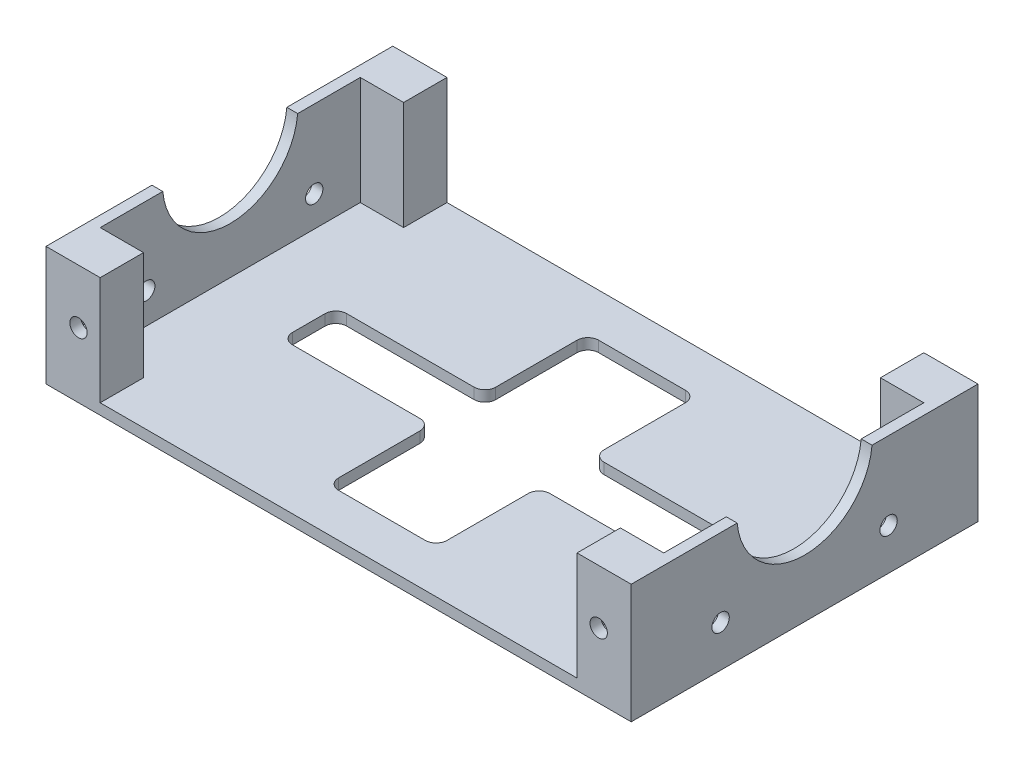
from build123d import *

# Parameters (mm, degrees)
SZKIC1_W                    = 104
SZKIC1_H                    = 64
DODANIE_WYCI_GNI_CIE1_DEPTH = 2
SZKIC2_W                    = 8
SZKIC2_H                    = 8
DODANIE_WYCI_GNI_CIE2_DEPTH = 20
SZKIC4_R                    = 1.6
DODANIE_WYCI_GNI_CIE3_DEPTH = 2
DODANIE_WYCI_GNI_CIE4_START = 2
SZKIC5_R                    = 1.6
DODANIE_WYCI_GNI_CIE4_DEPTH = 2
SFAZOWANIE1_SIZE            = 2
SZKIC6_W                    = 5.65685425
SZKIC6_H                    = 5.65685425
SZKIC6_R                    = 1.6
WYTNIJ_WYCI_GNI_CIE2_DEPTH  = 4
SZKIC6_AGAIN_R              = 1.6
WYTNIJ_WYCI_GNI_CIE3_DEPTH  = 6.2
DODANIE_WYCI_GNI_CIE5_DEPTH = 2
SZKIC8_W                    = 5.65685425
SZKIC8_H                    = 5.65685425
SZKIC8_R                    = 1.6
WYTNIJ_WYCI_GNI_CIE4_DEPTH  = 4
SZKIC8_2_R                  = 1.6
WYTNIJ_WYCI_GNI_CIE5_DEPTH  = 4.2
SZKIC8_3_W                  = 5.65685425
SZKIC8_3_H                  = 5.65685425
SZKIC8_3_R                  = 1.6
DODANIE_WYCI_GNI_CIE6_DEPTH = 2
WYTNIJ_WYCI_GNI_CIE6_START  = -4
SZKIC9_W                    = 5.65685425
SZKIC9_H                    = 5.65685425
SZKIC9_R                    = 1.6
WYTNIJ_WYCI_GNI_CIE6_DEPTH  = 4
WYTNIJ_WYCI_GNI_CIE7_START  = -4.2
SZKIC9_2_R                  = 1.6
WYTNIJ_WYCI_GNI_CIE7_DEPTH  = 4.2
DODANIE_WYCI_GNI_CIE7_START = -2
SZKIC9_3_W                  = 5.65685425
SZKIC9_3_H                  = 5.65685425
SZKIC9_3_R                  = 1.6
DODANIE_WYCI_GNI_CIE7_DEPTH = 2
SZKIC10_W                   = 20
SZKIC10_H                   = 10
SZKIC10_W_2                 = 27.5
SZKIC10_H_2                 = 19
WYTNIJ_WYCI_GNI_CIE8_DEPTH  = 9
SZKIC11_W                   = 2
SZKIC11_H                   = 2
DODANIE_WYCI_GNI_CIE8_DEPTH = 64
ZAOKR_GLENIE1_R             = 2


with BuildPart() as part:
    # Szkic1 → Dodanie-wyciągnięcie1 (new body)
    with BuildSketch(Plane(origin=(0, 0, 0), x_dir=(1, 0, 0), z_dir=(0, 1, 0))):
        with Locations((52, 32)):
            Rectangle(SZKIC1_W, SZKIC1_H)
    extrude(amount=DODANIE_WYCI_GNI_CIE1_DEPTH)

    # Szkic2 → Dodanie-wyciągnięcie2 (add)
    with BuildSketch(Plane(origin=(0, 2, 0), x_dir=(1, 0, 0), z_dir=(0, 1, 0))):
        with Locations((4, 60)):
            Rectangle(SZKIC2_W, SZKIC2_H)
        with Locations((4, 4)):
            Rectangle(SZKIC2_W, SZKIC2_H)
        with Locations((100, 4)):
            Rectangle(SZKIC2_W, SZKIC2_H)
        with Locations((100, 60)):
            Rectangle(SZKIC2_W, SZKIC2_H)
    extrude(amount=DODANIE_WYCI_GNI_CIE2_DEPTH)

    # Szkic4 → Dodanie-wyciągnięcie3 (add)
    # profile 1 of 2: a face of its own
    with BuildSketch(Plane.ZY):
        with BuildLine():
            Line((-8, 2), (-8, 22))
            Line((-8, 22), (-19.553012413, 22))
            ThreePointArc((-19.553012413, 22), (-32, 10.65), (-44.446987587, 22))
            Line((-44.446987587, 22), (-56, 22))
            Line((-56, 22), (-56, 2))
            Line((-56, 2), (-8, 2))
        make_face()
        with Locations((-47.5, 7.65)):
            Circle(SZKIC4_R, mode=Mode.SUBTRACT)
        with Locations((-16.5, 7.65)):
            Circle(SZKIC4_R, mode=Mode.SUBTRACT)
    # profile 2 of 2: a face of its own
    with BuildSketch(Plane.ZY):
        Polygon((-64, 22), (-64, 0), (0, 0), (0, 22), (-8, 22), (-8, 2), (-56, 2), (-56, 22), align=None)
    extrude(amount=DODANIE_WYCI_GNI_CIE3_DEPTH)

    # Szkic5 → Dodanie-wyciągnięcie4 (add)
    # profile 1 of 2: a face of its own
    with BuildSketch(Plane(origin=(104, 0, 0), x_dir=(0, 0, -1), z_dir=(1, 0, 0)).offset(DODANIE_WYCI_GNI_CIE4_START)):
        with BuildLine():
            Line((56, 2), (56, 22))
            Line((56, 22), (44.446987587, 22))
            ThreePointArc((44.446987587, 22), (32, 10.65), (19.553012413, 22))
            Line((19.553012413, 22), (8, 22))
            Line((8, 22), (8, 2))
            Line((8, 2), (56, 2))
        make_face()
        with Locations(Location((16.5, 7.65, 0), (0, 0, 180))):
            Circle(SZKIC5_R, mode=Mode.SUBTRACT)
        with Locations(Location((47.5, 7.65, 0), (0, 0, 180))):
            Circle(SZKIC5_R, mode=Mode.SUBTRACT)
    # profile 2 of 2: a face of its own
    with BuildSketch(Plane(origin=(104, 0, 0), x_dir=(0, 0, -1), z_dir=(1, 0, 0)).offset(DODANIE_WYCI_GNI_CIE4_START)):
        Polygon((0, 22), (0, 0), (64, 0), (64, 22), (56, 22), (56, 2), (8, 2), (8, 22), align=None)
    extrude(amount=-DODANIE_WYCI_GNI_CIE4_DEPTH)

    # Sfazowanie1
    sfazowanie1_edges = [part.edges().sort_by_distance(p)[0] for p in [
        (-2, 0, -32),
        (106, 0, -32),
    ]]
    chamfer(sfazowanie1_edges, length=SFAZOWANIE1_SIZE)

    # Szkic6 → Wytnij-wyciągnięcie2 (cut)
    # profile 1 of 4: a face of its own
    with BuildSketch(Plane.XZ):
        with Locations((4, -4)):
            Rectangle(SZKIC6_W, SZKIC6_H)
        with Locations(Location((4, -4, 0), (0, 0, 270))):
            Circle(SZKIC6_R, mode=Mode.SUBTRACT)
    # profile 2 of 4: a face of its own
    with BuildSketch(Plane.XZ):
        with Locations((4, -60)):
            Rectangle(SZKIC6_W, SZKIC6_H)
        with Locations(Location((4, -60, 0), (0, 0, 270))):
            Circle(SZKIC6_R, mode=Mode.SUBTRACT)
    # profile 3 of 4: a face of its own
    with BuildSketch(Plane.XZ):
        with Locations((100, -60)):
            Rectangle(SZKIC6_W, SZKIC6_H)
        with Locations(Location((100, -60, 0), (0, 0, 270))):
            Circle(SZKIC6_R, mode=Mode.SUBTRACT)
    # profile 4 of 4: a face of its own
    with BuildSketch(Plane.XZ):
        with Locations((100, -4)):
            Rectangle(SZKIC6_W, SZKIC6_H)
        with Locations(Location((100, -4, 0), (0, 0, 270))):
            Circle(SZKIC6_R, mode=Mode.SUBTRACT)
    extrude(amount=-WYTNIJ_WYCI_GNI_CIE2_DEPTH, mode=Mode.SUBTRACT)

    # Szkic6 again → Wytnij-wyciągnięcie3 (cut)
    with BuildSketch(Plane.XZ):
        with Locations(Location((4, -4, 0), (0, 0, 270))):
            Circle(SZKIC6_AGAIN_R)
        with Locations(Location((4, -60, 0), (0, 0, 270))):
            Circle(SZKIC6_AGAIN_R)
        with Locations(Location((100, -60, 0), (0, 0, 270))):
            Circle(SZKIC6_AGAIN_R)
        with Locations(Location((100, -4, 0), (0, 0, 270))):
            Circle(SZKIC6_AGAIN_R)
    extrude(amount=-WYTNIJ_WYCI_GNI_CIE3_DEPTH, mode=Mode.SUBTRACT)

    # Szkic6 → Dodanie-wyciągnięcie5 (add)
    # profile 1 of 4: a face of its own
    with BuildSketch(Plane.XZ):
        with Locations((4, -4)):
            Rectangle(SZKIC6_W, SZKIC6_H)
        with Locations(Location((4, -4, 0), (0, 0, 270))):
            Circle(SZKIC6_R, mode=Mode.SUBTRACT)
    # profile 2 of 4: a face of its own
    with BuildSketch(Plane.XZ):
        with Locations((4, -60)):
            Rectangle(SZKIC6_W, SZKIC6_H)
        with Locations(Location((4, -60, 0), (0, 0, 270))):
            Circle(SZKIC6_R, mode=Mode.SUBTRACT)
    # profile 3 of 4: a face of its own
    with BuildSketch(Plane.XZ):
        with Locations((100, -60)):
            Rectangle(SZKIC6_W, SZKIC6_H)
        with Locations(Location((100, -60, 0), (0, 0, 270))):
            Circle(SZKIC6_R, mode=Mode.SUBTRACT)
    # profile 4 of 4: a face of its own
    with BuildSketch(Plane.XZ):
        with Locations((100, -4)):
            Rectangle(SZKIC6_W, SZKIC6_H)
        with Locations(Location((100, -4, 0), (0, 0, 270))):
            Circle(SZKIC6_R, mode=Mode.SUBTRACT)
    extrude(amount=-DODANIE_WYCI_GNI_CIE5_DEPTH)

    # Szkic8 → Wytnij-wyciągnięcie4 (cut)
    # profile 1 of 2: a face of its own
    with BuildSketch(Plane(origin=(0, 0, -64), x_dir=(-1, 0, 0), z_dir=(0, 0, -1))):
        with Locations((-4, 12)):
            Rectangle(SZKIC8_W, SZKIC8_H)
        with Locations((-4, 12)):
            Circle(SZKIC8_R, mode=Mode.SUBTRACT)
    # profile 2 of 2: a face of its own
    with BuildSketch(Plane(origin=(0, 0, -64), x_dir=(-1, 0, 0), z_dir=(0, 0, -1))):
        with Locations((-100, 12)):
            Rectangle(SZKIC8_W, SZKIC8_H)
        with Locations((-100, 12)):
            Circle(SZKIC8_R, mode=Mode.SUBTRACT)
    extrude(amount=-WYTNIJ_WYCI_GNI_CIE4_DEPTH, mode=Mode.SUBTRACT)

    # Szkic8<2> → Wytnij-wyciągnięcie5 (cut)
    with BuildSketch(Plane(origin=(0, 0, -64), x_dir=(-1, 0, 0), z_dir=(0, 0, -1))):
        with Locations((-4, 12)):
            Circle(SZKIC8_2_R)
        with Locations((-100, 12)):
            Circle(SZKIC8_2_R)
    extrude(amount=-WYTNIJ_WYCI_GNI_CIE5_DEPTH, mode=Mode.SUBTRACT)

    # Szkic8<3> → Dodanie-wyciągnięcie6 (add)
    # profile 1 of 2: a face of its own
    with BuildSketch(Plane(origin=(0, 0, -64), x_dir=(-1, 0, 0), z_dir=(0, 0, -1))):
        with Locations((-4, 12)):
            Rectangle(SZKIC8_3_W, SZKIC8_3_H)
        with Locations((-4, 12)):
            Circle(SZKIC8_3_R, mode=Mode.SUBTRACT)
    # profile 2 of 2: a face of its own
    with BuildSketch(Plane(origin=(0, 0, -64), x_dir=(-1, 0, 0), z_dir=(0, 0, -1))):
        with Locations((-100, 12)):
            Rectangle(SZKIC8_3_W, SZKIC8_3_H)
        with Locations((-100, 12)):
            Circle(SZKIC8_3_R, mode=Mode.SUBTRACT)
    extrude(amount=-DODANIE_WYCI_GNI_CIE6_DEPTH)

    # Szkic9 → Wytnij-wyciągnięcie6 (cut)
    # profile 1 of 2: a face of its own
    with BuildSketch(Plane.XY.offset(WYTNIJ_WYCI_GNI_CIE6_START)):
        with Locations((100, 12)):
            Rectangle(SZKIC9_W, SZKIC9_H)
        with Locations(Location((100, 12, 0), (0, 0, 180))):
            Circle(SZKIC9_R, mode=Mode.SUBTRACT)
    # profile 2 of 2: a face of its own
    with BuildSketch(Plane.XY.offset(WYTNIJ_WYCI_GNI_CIE6_START)):
        with Locations((4, 12)):
            Rectangle(SZKIC9_W, SZKIC9_H)
        with Locations(Location((4, 12, 0), (0, 0, 180))):
            Circle(SZKIC9_R, mode=Mode.SUBTRACT)
    extrude(amount=WYTNIJ_WYCI_GNI_CIE6_DEPTH, mode=Mode.SUBTRACT)

    # Szkic9<2> → Wytnij-wyciągnięcie7 (cut)
    with BuildSketch(Plane.XY.offset(WYTNIJ_WYCI_GNI_CIE7_START)):
        with Locations(Location((100, 12, 0), (0, 0, 180))):
            Circle(SZKIC9_2_R)
        with Locations(Location((4, 12, 0), (0, 0, 180))):
            Circle(SZKIC9_2_R)
    extrude(amount=WYTNIJ_WYCI_GNI_CIE7_DEPTH, mode=Mode.SUBTRACT)

    # Szkic9<3> → Dodanie-wyciągnięcie7 (add)
    # profile 1 of 2: a face of its own
    with BuildSketch(Plane.XY.offset(DODANIE_WYCI_GNI_CIE7_START)):
        with Locations((100, 12)):
            Rectangle(SZKIC9_3_W, SZKIC9_3_H)
        with Locations(Location((100, 12, 0), (0, 0, 180))):
            Circle(SZKIC9_3_R, mode=Mode.SUBTRACT)
    # profile 2 of 2: a face of its own
    with BuildSketch(Plane.XY.offset(DODANIE_WYCI_GNI_CIE7_START)):
        with Locations((4, 12)):
            Rectangle(SZKIC9_3_W, SZKIC9_3_H)
        with Locations(Location((4, 12, 0), (0, 0, 180))):
            Circle(SZKIC9_3_R, mode=Mode.SUBTRACT)
    extrude(amount=DODANIE_WYCI_GNI_CIE7_DEPTH)

    # Szkic10 → Wytnij-wyciągnięcie8 (cut)
    with BuildSketch(Plane.XZ):
        with Locations((52, -32)):
            Rectangle(SZKIC10_W, SZKIC10_H)
        with Locations((28.25, -32)):
            Rectangle(SZKIC10_W_2, SZKIC10_H)
        with Locations((52, -17.5)):
            Rectangle(SZKIC10_W, SZKIC10_H_2)
        with Locations((52, -46.5)):
            Rectangle(SZKIC10_W, SZKIC10_H_2)
        with Locations((75.75, -32)):
            Rectangle(SZKIC10_W_2, SZKIC10_H)
    extrude(amount=-WYTNIJ_WYCI_GNI_CIE8_DEPTH, mode=Mode.SUBTRACT)

    # Szkic11 → Dodanie-wyciągnięcie8 (add)
    with BuildSketch(Plane.XY):
        with Locations((-1, 1)):
            Rectangle(SZKIC11_W, SZKIC11_H)
        with Locations((105, 1)):
            Rectangle(SZKIC11_W, SZKIC11_H)
    extrude(amount=-DODANIE_WYCI_GNI_CIE8_DEPTH)

    # Zaokrąglenie1
    zaokr_glenie1_edges = [part.edges().sort_by_distance(p)[0] for p in [
        (42, 1, -37),
        (14.5, 1, -37),
        (14.5, 1, -27),
        (42, 1, -27),
        (42, 1, -8),
        (62, 1, -8),
        (62, 1, -27),
        (89.5, 1, -27),
        (89.5, 1, -37),
        (62, 1, -37),
        (62, 1, -56),
        (42, 1, -56),
    ]]
    fillet(zaokr_glenie1_edges, radius=ZAOKR_GLENIE1_R)


solid = part.part
